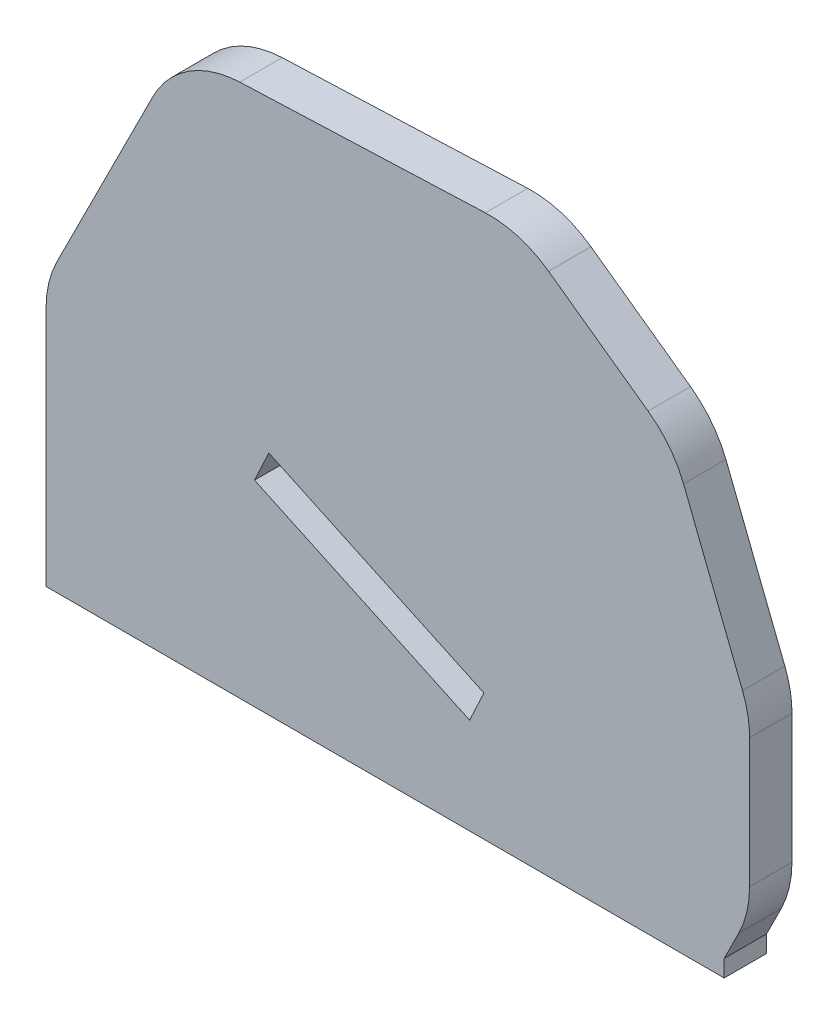
from build123d import *

# Parameters (mm, degrees)
BOSS_EXTRUDE1_DEPTH = 0.125
FILLET1_R           = 0.6


with BuildPart() as part:
    # frame_outline → Boss-Extrude1 (new, symmetric)
    with BuildSketch(Plane.XY):
        Polygon((0, 0), (4, 0), (4, 0.1), (4.15, 0.4), (4.15, 1.416096183), (3.695232724, 2.568743907), (2.797078859, 3.212298026), (0.789408464, 3.133982378), (0, 1.562826413), align=None)
        Polygon((1.229765114, 1.157816865), (2.498596016, 0.566151298), (2.583119668, 0.747412856), (1.314288766, 1.339078422), align=None, mode=Mode.SUBTRACT)
    extrude(amount=BOSS_EXTRUDE1_DEPTH, both=True)

    # Fillet1
    fillet1_edges = [part.edges().sort_by_distance(p)[0] for p in [
        (0, 1.562826413, 0),
        (0.789408464, 3.133982378, 0),
        (2.797078859, 3.212298026, 0),
        (3.695232724, 2.568743907, 0),
        (4.15, 1.416096183, 0),
        (4.15, 0.4, 0),
    ]]
    fillet(fillet1_edges, radius=FILLET1_R)


solid = part.part
